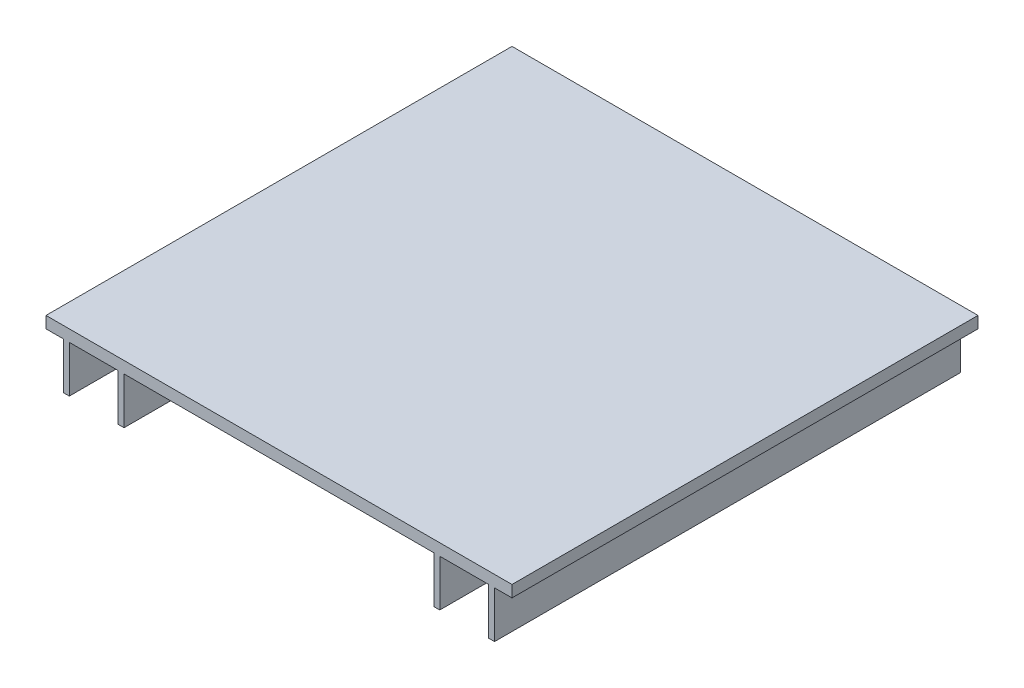
from build123d import *

# Parameters (mm, degrees)
SKETCH_1_W      = 200
SKETCH_1_H      = 200
EXTRUDE_1_DEPTH = 5
SKETCH_2_W      = 2.5
SKETCH_2_H      = 200
EXTRUDE_2_DEPTH = 20


with BuildPart() as part:
    # 草图1 → 凸台-拉伸1 (new body)
    with BuildSketch(Plane(origin=(0, 0, 0), x_dir=(1, 0, 0), z_dir=(0, 1, 0))):
        Rectangle(SKETCH_1_W, SKETCH_1_H)
    extrude(amount=EXTRUDE_1_DEPTH)

    # 草图2 → 凸台-拉伸2 (add)
    with BuildSketch(Plane.XZ):
        with Locations((-67.75, 0)):
            Rectangle(SKETCH_2_W, SKETCH_2_H)
        with Locations((-91.25, 0)):
            Rectangle(SKETCH_2_W, SKETCH_2_H)
    extrude_2 = extrude(amount=EXTRUDE_2_DEPTH)

    # 镜向1: 凸台-拉伸2 across plane
    add(extrude_2.mirror(Plane(origin=(0, 0, 0), x_dir=(0, 0, 1), z_dir=(1, 0, 0))))


solid = part.part
